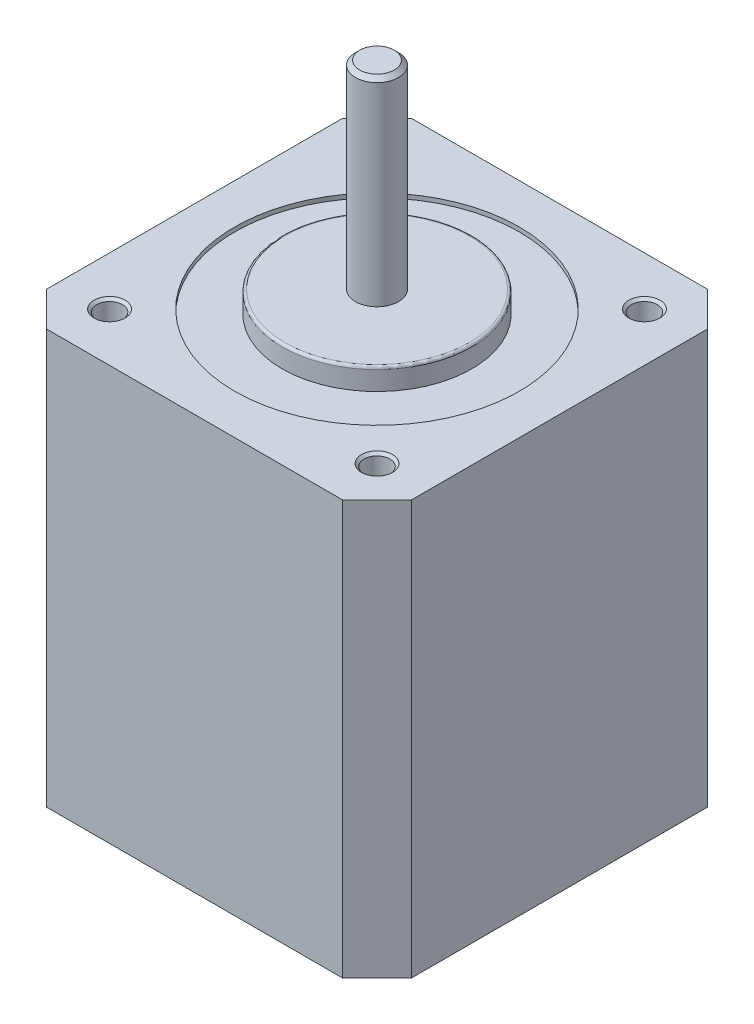
from build123d import *

# Parameters (mm, degrees)
SKETCH1_W                    = 42.3
SKETCH1_H                    = 42.3
BOSS_EXTRUDE1_DEPTH          = 48
SKETCH2_R                    = 11
BOSS_EXTRUDE2_DEPTH          = 2
SKETCH3_R                    = 2.5
BOSS_EXTRUDE3_DEPTH          = 23
FILLET2_R                    = 0.3
CHAMFER1_SIZE                = 0.5
SKETCH4_R                    = 1.5
CUT_EXTRUDE1_DEPTH           = 4.5
CHAMFER2_SIZE                = 0.3
CUT_EXTRUDE2_START           = -0.5
SKETCH5_R                    = 16.5
SKETCH5_R_2                  = 11
CUT_EXTRUDE2_DEPTH           = 0.5
CUT_EXTRUDE_THIN1_DEPTH      = 57.556564606
CUT_EXTRUDE_THIN1_DEPTH_BACK = 57.556564606
SKETCH7_R                    = 3.5
SKETCH7_R_2                  = 3
CUT_EXTRUDE3_DEPTH           = 5
SKETCH8_W                    = 8
SKETCH8_H                    = 5
BOSS_EXTRUDE4_DEPTH          = 2
FILLET3_R                    = 1


with BuildPart() as part:
    # Sketch1 → Boss-Extrude1 (new body)
    with BuildSketch(Plane(origin=(0, 0, 0), x_dir=(1, 0, 0), z_dir=(0, 1, 0))):
        Rectangle(SKETCH1_W, SKETCH1_H)
    extrude(amount=BOSS_EXTRUDE1_DEPTH)

    # Sketch2 → Boss-Extrude2 (add)
    with BuildSketch(Plane(origin=(0, 48, 0), x_dir=(1, 0, 0), z_dir=(0, 1, 0))):
        with Locations(Location((0, 0, 0), (0, 0, 90))):
            Circle(SKETCH2_R)
    extrude(amount=BOSS_EXTRUDE2_DEPTH)

    # Sketch3 → Boss-Extrude3 (add)
    with BuildSketch(Plane(origin=(0, 50, 0), x_dir=(1, 0, 0), z_dir=(0, 1, 0))):
        with Locations(Location((0, 0, 0), (0, 0, 270))):
            Circle(SKETCH3_R)
    extrude(amount=BOSS_EXTRUDE3_DEPTH)

    # Fillet2
    fillet2_edges = [part.edges().sort_by_distance(p)[0] for p in [
        (0, 50, 11),
    ]]
    fillet(fillet2_edges, radius=FILLET2_R)

    # Chamfer1
    chamfer1_edges = [part.edges().sort_by_distance(p)[0] for p in [
        (0, 73, -2.5),
    ]]
    chamfer(chamfer1_edges, length=CHAMFER1_SIZE)

    # Sketch4 → Cut-Extrude1 (cut)
    with BuildSketch(Plane(origin=(0, 48, 0), x_dir=(1, 0, 0), z_dir=(0, 1, 0))):
        with Locations(Location((-15.5, -15.5, 0), (0, 0, 270))):
            Circle(SKETCH4_R)
        with Locations(Location((15.5, -15.5, 0), (0, 0, 270))):
            Circle(SKETCH4_R)
        with Locations(Location((15.5, 15.5, 0), (0, 0, 270))):
            Circle(SKETCH4_R)
        with Locations(Location((-15.5, 15.5, 0), (0, 0, 270))):
            Circle(SKETCH4_R)
    extrude(amount=-CUT_EXTRUDE1_DEPTH, mode=Mode.SUBTRACT)

    # Chamfer2
    chamfer2_edges = [part.edges().sort_by_distance(p)[0] for p in [
        (-15.5, 48, 14),
        (15.5, 48, 14),
        (15.5, 48, -17),
        (-15.5, 48, -17),
    ]]
    chamfer(chamfer2_edges, length=CHAMFER2_SIZE)

    # Sketch5 → Cut-Extrude2 (cut)
    with BuildSketch(Plane(origin=(0, 48, 0), x_dir=(1, 0, 0), z_dir=(0, 1, 0)).offset(CUT_EXTRUDE2_START)):
        with Locations(Location((0, 0, 0), (0, 0, 270))):
            Circle(SKETCH5_R)
        with Locations(Location((0, 0, 0), (0, 0, 270))):
            Circle(SKETCH5_R_2, mode=Mode.SUBTRACT)
    extrude(amount=CUT_EXTRUDE2_DEPTH, mode=Mode.SUBTRACT)

    # Sketch6 → Cut-Extrude-Thin1 (cut, two sides: drawn at the far end of the back side and taken through both)
    with BuildSketch(Plane(origin=(0, 48, 0), x_dir=(1, 0, 0), z_dir=(0, 1, 0)).offset(-CUT_EXTRUDE_THIN1_DEPTH_BACK)):
        Polygon((-21.15, -17.15), (-17.15, -21.15), (-24.221067812, -28.221067812), (-28.221067812, -24.221067812), align=None)
        Polygon((17.15, -21.15), (21.15, -17.15), (28.221067812, -24.221067812), (24.221067812, -28.221067812), align=None)
        Polygon((21.15, 17.15), (17.15, 21.15), (24.221067812, 28.221067812), (28.221067812, 24.221067812), align=None)
        Polygon((-17.15, 21.15), (-21.15, 17.15), (-28.221067812, 24.221067812), (-24.221067812, 28.221067812), align=None)
    extrude(amount=CUT_EXTRUDE_THIN1_DEPTH + CUT_EXTRUDE_THIN1_DEPTH_BACK, mode=Mode.SUBTRACT)

    # Sketch7 → Cut-Extrude3 (cut)
    with BuildSketch(Plane.XZ):
        with Locations(Location((0, 0, 0), (0, 0, 270))):
            Circle(SKETCH7_R)
        with Locations(Location((-15.5, 15.5, 0), (0, 0, 270))):
            Circle(SKETCH7_R_2)
        with Locations(Location((15.5, 15.5, 0), (0, 0, 270))):
            Circle(SKETCH7_R_2)
        with Locations(Location((15.5, -15.5, 0), (0, 0, 270))):
            Circle(SKETCH7_R_2)
        with Locations(Location((-15.5, -15.5, 0), (0, 0, 270))):
            Circle(SKETCH7_R_2)
    extrude(amount=-CUT_EXTRUDE3_DEPTH, mode=Mode.SUBTRACT)

    # Sketch8 → Boss-Extrude4 (add)
    with BuildSketch(Plane.ZY.offset(21.15)):
        with Locations((0, 5)):
            Rectangle(SKETCH8_W, SKETCH8_H)
    extrude(amount=BOSS_EXTRUDE4_DEPTH)

    # Fillet3
    fillet3_edges = [part.edges().sort_by_distance(p)[0] for p in [
        (-23.15, 5, 4),
        (-23.15, 7.5, 0),
        (-23.15, 5, -4),
        (-23.15, 2.5, 0),
    ]]
    fillet(fillet3_edges, radius=FILLET3_R)


solid = part.part
